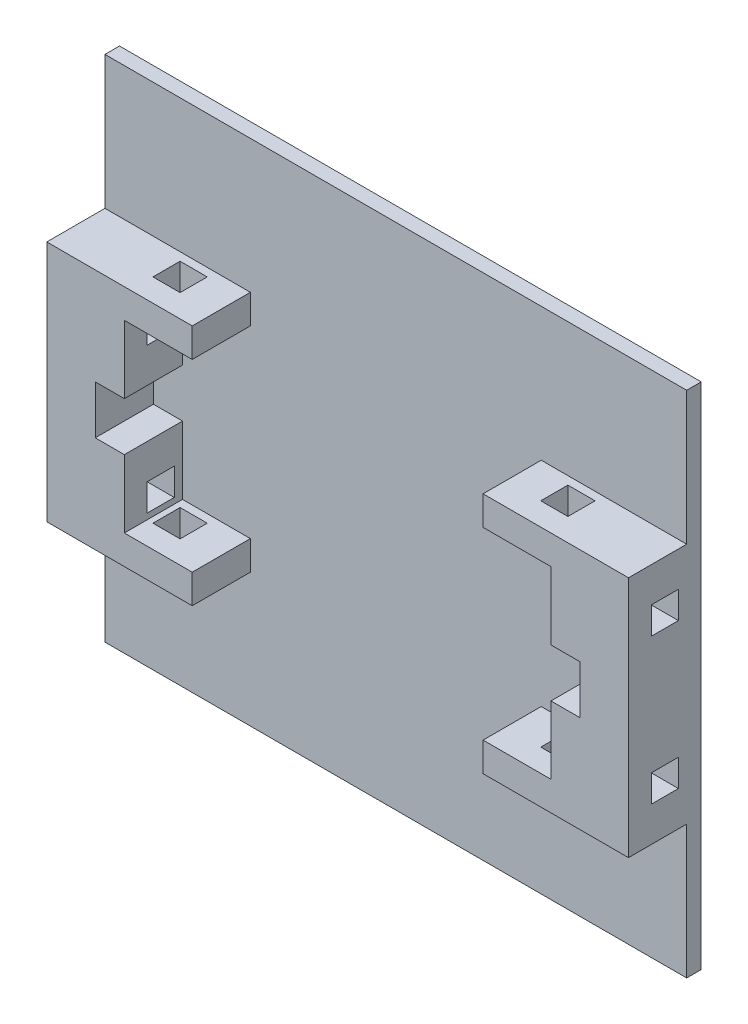
from build123d import *

# Parameters (mm, degrees)
ESBO_O1_R                = 8.3
RESSALTO_EXTRUS_O1_DEPTH = 1.5
RESSALTO_EXTRUS_O2_DEPTH = 6
ESBO_O3_W                = 2.8
ESBO_O3_H                = 2.8
CORTE_EXTRUS_O1_DEPTH    = 37.142080737
ESBO_O4_W                = 2.8
ESBO_O4_H                = 2.8
CORTE_EXTRUS_O2_DEPTH    = 53.08166664
ESBO_O6_W                = 5
ESBO_O6_H                = 25
RESSALTO_EXTRUS_O5_DEPTH = 7.5
ESBO_O7_W                = 2.8
ESBO_O7_H                = 2.8
CORTE_EXTRUS_O3_DEPTH    = 60
ESBO_O8_W                = 60
ESBO_O8_H                = 52.5
ESBO_O8_R                = 8.3
RESSALTO_EXTRUS_O6_DEPTH = 1.5
ESBO_O9_R                = 8.3
RESSALTO_EXTRUS_O7_DEPTH = 1.5


with BuildPart() as part:
    # Esboço1 → Ressalto-extrusão1 (new body)
    with BuildSketch(Plane.XY):
        Polygon((-25, -12.5), (-25, 12.5), (25, 12.5), (25, -12.5), (15, -12.5), (-15, -12.5), align=None)
        with Locations((-13, 0)):
            Circle(ESBO_O1_R, mode=Mode.SUBTRACT)
        with Locations(Location((13, 0, 0), (0, 0, 180))):
            Circle(ESBO_O1_R, mode=Mode.SUBTRACT)
    extrude(amount=RESSALTO_EXTRUS_O1_DEPTH)

    # Esboço2 → Ressalto-extrusão2 (add)
    with BuildSketch(Plane.XY.offset(1.5)):
        Polygon((-20, -12.5), (-25, -12.5), (-25, -2.5), (-22, -2.5), (-22, -9.5), (-15, -9.5), (-15, -12.5), align=None)
        Polygon((22, -2.5), (22, -9.5), (15, -9.5), (15, -12.5), (20, -12.5), (25, -12.5), (25, -2.5), align=None)
        Polygon((20, 12.5), (25, 12.5), (25, 2.5), (22, 2.5), (22, 9.5), (15, 9.5), (15, 12.5), align=None)
        Polygon((-22, 2.5), (-22, 9.5), (-15, 9.5), (-15, 12.5), (-20, 12.5), (-25, 12.5), (-25, 2.5), align=None)
    extrude(amount=RESSALTO_EXTRUS_O2_DEPTH)

    # Esboço3 → Corte-extrusão1 (cut, through all)
    with BuildSketch(Plane.XZ.offset(12.5)):
        with Locations((-20, 3.75)):
            Rectangle(ESBO_O3_W, ESBO_O3_H)
        with Locations((20, 3.75)):
            Rectangle(ESBO_O3_W, ESBO_O3_H)
    extrude(amount=-CORTE_EXTRUS_O1_DEPTH, mode=Mode.SUBTRACT)

    # Esboço4 → Corte-extrusão2 (cut, through all)
    with BuildSketch(Plane.ZY.offset(25)):
        with Locations((3.75, 7.5)):
            Rectangle(ESBO_O4_W, ESBO_O4_H)
        with Locations((3.75, -7.5)):
            Rectangle(ESBO_O4_W, ESBO_O4_H)
    extrude(amount=-CORTE_EXTRUS_O2_DEPTH, mode=Mode.SUBTRACT)

    # Esboço6 → Ressalto-extrusão5 (add)
    with BuildSketch(Plane(origin=(0, 0, 0), x_dir=(-1, 0, 0), z_dir=(0, 0, -1))):
        with Locations((-27.5, 0)):
            Rectangle(ESBO_O6_W, ESBO_O6_H)
        with Locations((27.5, 0)):
            Rectangle(ESBO_O6_W, ESBO_O6_H)
    extrude(amount=-RESSALTO_EXTRUS_O5_DEPTH)

    # Esboço7 → Corte-extrusão3 (cut)
    with BuildSketch(Plane(origin=(30, 0, 0), x_dir=(0, 0, -1), z_dir=(1, 0, 0))):
        with Locations((-3.75, -7.5)):
            Rectangle(ESBO_O7_W, ESBO_O7_H)
        with Locations((-3.75, 7.5)):
            Rectangle(ESBO_O7_W, ESBO_O7_H)
    extrude(amount=-CORTE_EXTRUS_O3_DEPTH, mode=Mode.SUBTRACT)

    # Esboço8 → Ressalto-extrusão6 (add)
    with BuildSketch(Plane(origin=(0, 0, 0), x_dir=(-1, 0, 0), z_dir=(0, 0, -1))):
        Rectangle(ESBO_O8_W, ESBO_O8_H)
        with Locations(Location((13, 0, 0), (0, 0, 180))):
            Circle(ESBO_O8_R, mode=Mode.SUBTRACT)
        with Locations((-13, 0)):
            Circle(ESBO_O8_R, mode=Mode.SUBTRACT)
    extrude(amount=-RESSALTO_EXTRUS_O6_DEPTH)

    # Esboço9 → Ressalto-extrusão7 (add, through all)
    with BuildSketch(Plane.XY.offset(1.5)):
        with Locations((-13, 0)):
            Circle(ESBO_O9_R)
        with Locations((13, 0)):
            Circle(ESBO_O9_R)
    extrude(amount=-RESSALTO_EXTRUS_O7_DEPTH)


solid = part.part
